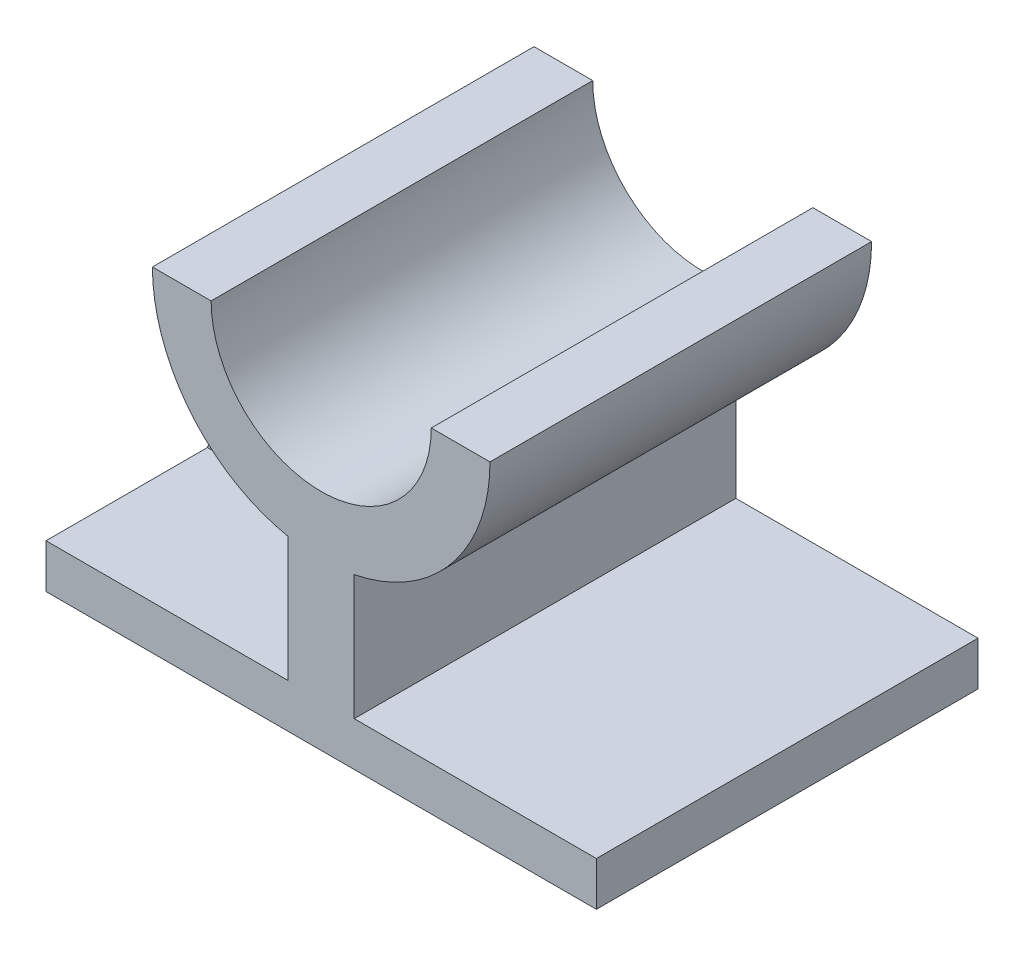
from build123d import *

# Parameters (mm, degrees)
BOSS_EXTRUDE1_DEPTH = 520
RIB15_REACH         = 866.242
SKETCH14_WALL_W     = 2151.777513516
SKETCH14_WALL_H     = 80


with BuildPart() as part:
    # Sketch1 → Boss-Extrude1 (new body)
    with BuildSketch(Plane.XY):
        with BuildLine():
            Line((-63.134983493, 0), (686.865016507, 0))
            Line((686.865016507, 0), (686.865016507, 60))
            Line((686.865016507, 60), (356.865016507, 60))
            Line((356.865016507, 60), (356.865016507, 230))
            ThreePointArc((356.865016507, 230), (489.699208945, 309.695349915), (541.865016507, 455.554871373))
            Line((541.865016507, 455.554871373), (461.865016507, 455.554871373))
            ThreePointArc((461.865016507, 455.554871373), (311.865016507, 305.554871373), (161.865016507, 455.554871373))
            Line((161.865016507, 455.554871373), (81.865016507, 455.554871373))
            ThreePointArc((81.865016507, 455.554871373), (134.03082407, 309.695349915), (266.865016507, 230))
            Line((266.865016507, 230), (266.865016507, 60))
            Line((266.865016507, 60), (-63.134983493, 60))
            Line((-63.134983493, 60), (-63.134983493, 0))
        make_face()
    extrude(amount=-BOSS_EXTRUDE1_DEPTH)

    # Sketch14 wall → Rib15 (add, up to next)
    with BuildSketch(Plane(origin=(9.365016507, 257.777435686, -260), x_dir=(-0.344177678967, -0.938904534711, 0), z_dir=(-0.938904534711, 0.344177678967, 0)), mode=Mode.PRIVATE) as rib15_sk1:
        Rectangle(SKETCH14_WALL_W, SKETCH14_WALL_H)
    rib15_tool1 = extrude(rib15_sk1.sketch, amount=-RIB15_REACH, mode=Mode.PRIVATE) - part.part
    add(rib15_tool1.solids().sort_by_distance((9.365016507, 257.777435686, -260))[0])


solid = part.part
